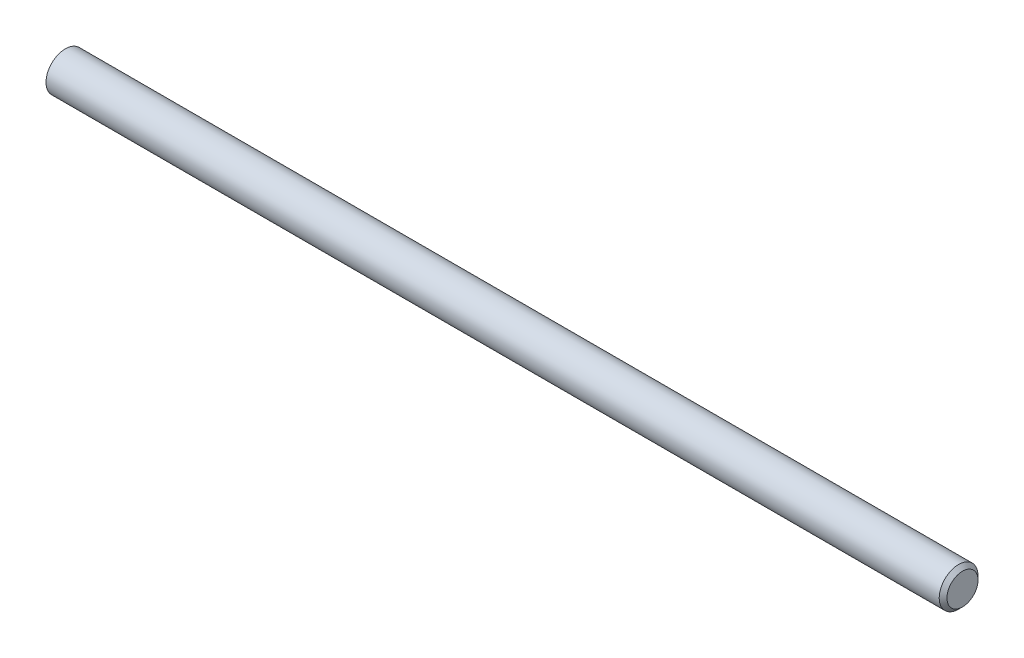
from build123d import *


with BuildPart() as part:
    # Croquis1 → Revolución1 (revolve)
    with BuildSketch(Plane(origin=(0, 0, 0), x_dir=(1, 0, 0), z_dir=(0, 1, 0)), mode=Mode.PRIVATE) as revoluci_n1_sk:
        Polygon((0, 0), (185, 0), (185, 3.2), (184.2, 4), (0, 4), align=None)
    revolve(revoluci_n1_sk.sketch.rotate(Axis((0, 0, 0), (1, 0, 0)), 180), axis=Axis((0, 0, 0), (1, 0, 0)))


solid = part.part
